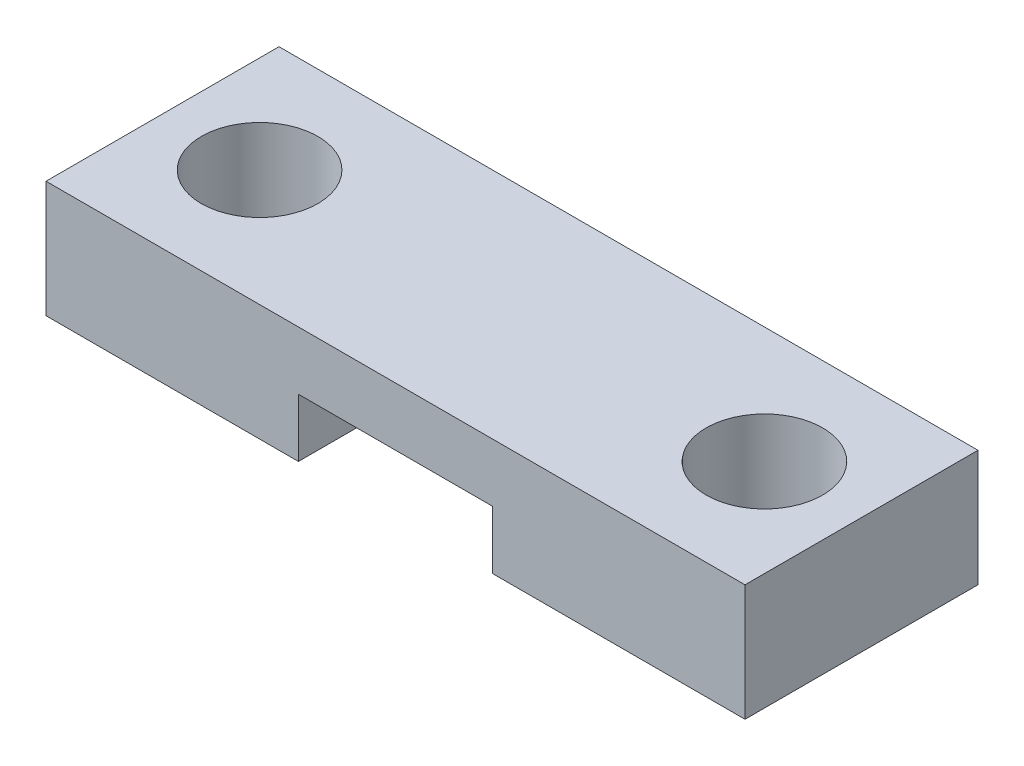
from build123d import *

# Parameters (mm, degrees)
SKETCH1_W           = 18
SKETCH1_H           = 6
SKETCH1_R           = 1.5
BOSS_EXTRUDE1_DEPTH = 3
SKETCH2_W           = 5
SKETCH2_H           = 1.5
CUT_EXTRUDE1_DEPTH  = 12.22497216


with BuildPart() as part:
    # Sketch1 → Boss-Extrude1 (new body)
    with BuildSketch(Plane(origin=(0, 0, 0), x_dir=(1, 0, 0), z_dir=(0, 1, 0))):
        Rectangle(SKETCH1_W, SKETCH1_H)
        with Locations(Location((-6.5, 0, 0), (0, 0, 270))):
            Circle(SKETCH1_R, mode=Mode.SUBTRACT)
        with Locations(Location((6.5, 0, 0), (0, 0, 270))):
            Circle(SKETCH1_R, mode=Mode.SUBTRACT)
    extrude(amount=BOSS_EXTRUDE1_DEPTH)

    # Sketch2 → Cut-Extrude1 (cut, through all)
    with BuildSketch(Plane.XY.offset(3)):
        with Locations((0, 0.75)):
            Rectangle(SKETCH2_W, SKETCH2_H)
    extrude(amount=-CUT_EXTRUDE1_DEPTH, mode=Mode.SUBTRACT)


solid = part.part
